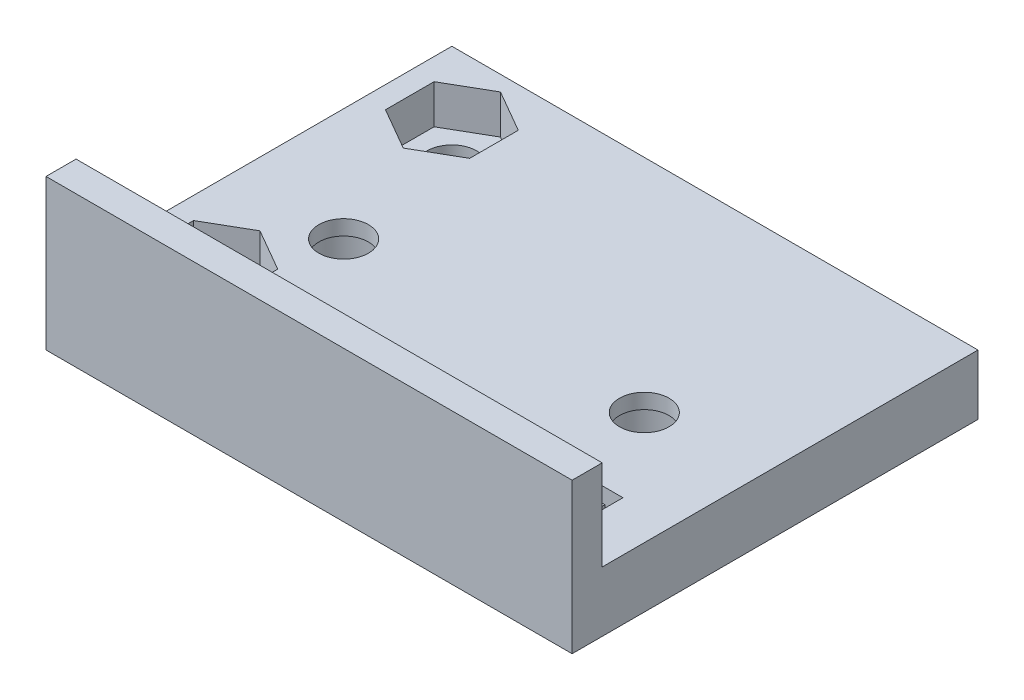
from build123d import *

# Parameters (mm, degrees)
SKETCH3_W           = 35
SKETCH3_H           = 27
SKETCH3_R           = 1.65
BOSS_EXTRUDE2_DEPTH = 4
SKETCH5_W           = 35
SKETCH5_H           = 2
BOSS_EXTRUDE3_DEPTH = 6
SKETCH7_R           = 1.65
CUT_EXTRUDE2_DEPTH  = 4
CUT_EXTRUDE3_DEPTH  = 2.6
SKETCH9_R           = 2.7
CUT_EXTRUDE4_DEPTH  = 3
SKETCH10_W          = 1.2
SKETCH10_H          = 2.8
CUT_EXTRUDE5_DEPTH  = 4
SKETCH11_W          = 6
SKETCH11_H          = 2.8
CUT_EXTRUDE6_DEPTH  = 1


with BuildPart() as part:
    # Sketch3 → Boss-Extrude2 (new body)
    with BuildSketch(Plane(origin=(0, 0, 0), x_dir=(1, 0, 0), z_dir=(0, 1, 0))):
        Rectangle(SKETCH3_W, SKETCH3_H)
        with Locations(Location((10, -1.2, 0), (0, 0, 270))):
            Circle(SKETCH3_R, mode=Mode.SUBTRACT)
        with Locations(Location((-10, -1.2, 0), (0, 0, 90))):
            Circle(SKETCH3_R, mode=Mode.SUBTRACT)
    extrude(amount=BOSS_EXTRUDE2_DEPTH)

    # Sketch5 → Boss-Extrude3 (add)
    with BuildSketch(Plane(origin=(0, 4, 0), x_dir=(1, 0, 0), z_dir=(0, 1, 0))):
        with Locations((0, -12.5)):
            Rectangle(SKETCH5_W, SKETCH5_H)
    extrude(amount=BOSS_EXTRUDE3_DEPTH)

    # Sketch7 → Cut-Extrude2 (cut)
    with BuildSketch(Plane.XZ):
        with Locations(Location((-13.25, -9.25, 0), (0, 0, 270))):
            Circle(SKETCH7_R)
        with Locations(Location((-13.25, 6.75, 0), (0, 0, 270))):
            Circle(SKETCH7_R)
    extrude(amount=-CUT_EXTRUDE2_DEPTH, mode=Mode.SUBTRACT)

    # Sketch8 → Cut-Extrude3 (cut)
    with BuildSketch(Plane(origin=(0, 4, 0), x_dir=(1, 0, 0), z_dir=(0, 1, 0))):
        Polygon((-10.45, 7.633419246), (-10.45, 10.866580754), (-13.25, 12.483161507), (-16.05, 10.866580754), (-16.05, 7.633419246), (-13.25, 6.016838493), align=None)
        Polygon((-10.45, -5.133419246), (-13.25, -3.516838493), (-16.05, -5.133419246), (-16.05, -8.366580754), (-13.25, -9.983161507), (-10.45, -8.366580754), align=None)
    extrude(amount=-CUT_EXTRUDE3_DEPTH, mode=Mode.SUBTRACT)

    # Sketch9 → Cut-Extrude4 (cut)
    with BuildSketch(Plane.XZ):
        with Locations(Location((-10, 1.2, 0), (0, 0, 270))):
            Circle(SKETCH9_R)
        with Locations(Location((10, 1.2, 0), (0, 0, 270))):
            Circle(SKETCH9_R)
    extrude(amount=-CUT_EXTRUDE4_DEPTH, mode=Mode.SUBTRACT)

    # Sketch10 → Cut-Extrude5 (cut)
    with BuildSketch(Plane.XZ):
        with Locations((6.4, 8.219052272)):
            Rectangle(SKETCH10_W, SKETCH10_H)
        with Locations((13.6, 8.219052272)):
            Rectangle(SKETCH10_W, SKETCH10_H)
    extrude(amount=-CUT_EXTRUDE5_DEPTH, mode=Mode.SUBTRACT)

    # Sketch11 → Cut-Extrude6 (cut)
    with BuildSketch(Plane(origin=(0, 4, 0), x_dir=(1, 0, 0), z_dir=(0, 1, 0))):
        with Locations((10, -8.219052272)):
            Rectangle(SKETCH11_W, SKETCH11_H)
    extrude(amount=-CUT_EXTRUDE6_DEPTH, mode=Mode.SUBTRACT)


solid = part.part
